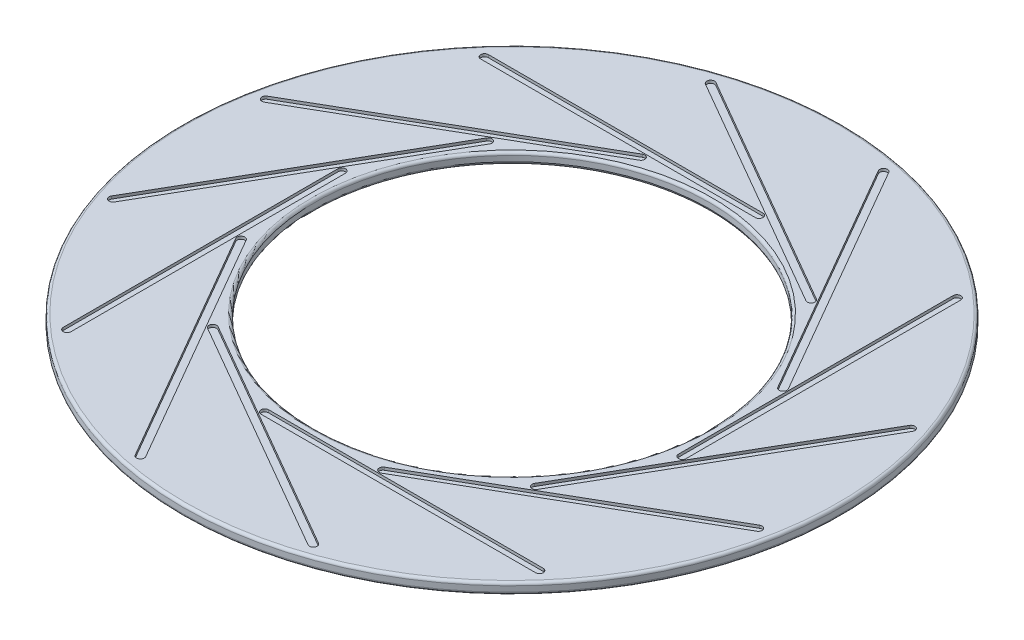
from build123d import *

# Parameters (mm, degrees)
SKETCH2_R            = 60
SKETCH2_R_2          = 36
RING_EXTRUSION_DEPTH = 2
GROOVES_DEPTH        = 0.5
CIRPATTERN2_COUNT    = 12
FILLET3_R            = 0.5


with BuildPart() as part:
    # Sketch2 → ring extrusion (new body)
    with BuildSketch(Plane(origin=(0, 0, 0), x_dir=(1, 0, 0), z_dir=(0, 1, 0))):
        with Locations(Location((0, 0, 0), (0, 0, 270))):
            Circle(SKETCH2_R)
        with Locations(Location((0, 0, 0), (0, 0, 270))):
            Circle(SKETCH2_R_2, mode=Mode.SUBTRACT)
    extrude(amount=RING_EXTRUSION_DEPTH)

    # Sketch5 → grooves (cut)
    with BuildSketch(Plane(origin=(0, 2, 0), x_dir=(1, 0, 0), z_dir=(0, 1, 0))):
        with BuildLine():
            Line((-43, 38.7), (7, 38.7))
            ThreePointArc((7, 38.7), (7.7, 38), (7, 37.3))
            Line((7, 37.3), (-43, 37.3))
            ThreePointArc((-43, 37.3), (-43.7, 38), (-43, 38.7))
        make_face()
    grooves = extrude(amount=-GROOVES_DEPTH, mode=Mode.SUBTRACT)

    # CirPattern2: grooves ×12 about axis
    cirpattern2_axis = Axis((0, 0, 0), (0, 1, 0))
    for i in range(1, CIRPATTERN2_COUNT):
        add(grooves.rotate(cirpattern2_axis, i * 360 / CIRPATTERN2_COUNT), mode=Mode.SUBTRACT)

    # Fillet3
    fillet3_edges = [part.edges().sort_by_distance(p)[0] for p in [
        (0, 0, -60),
        (0, 2, -60),
        (0, 0, -36),
        (0, 2, -36),
    ]]
    fillet(fillet3_edges, radius=FILLET3_R)


solid = part.part
